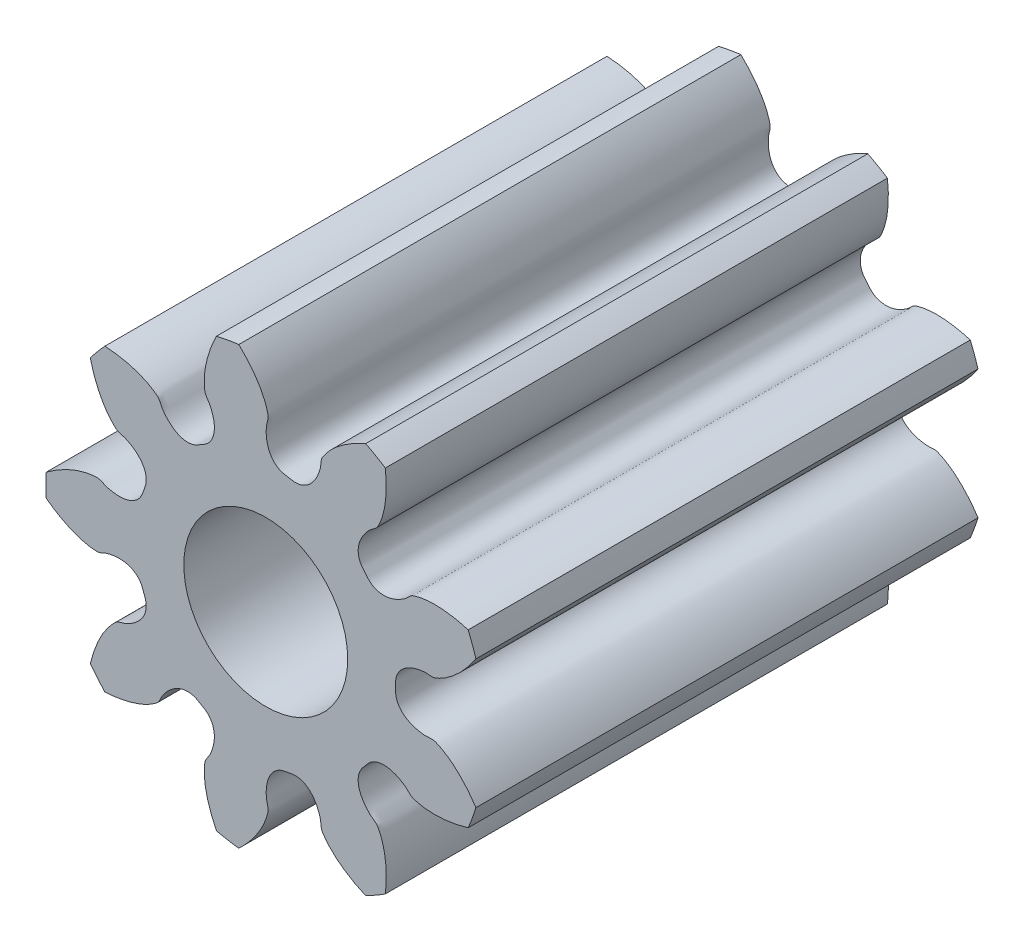
from build123d import *

# Parameters (mm, degrees)
SKETCHREVOLVESPURPINION_W       = 2.45
SKETCHREVOLVESPURPINION_H       = 1.072499984
TOOTHEXTRUDECUTSPURPINION_DEPTH = 9.525
PATTERNSPURPINION_COUNT         = 9
SKETCH5_R                       = 0.4
CUT_EXTRUDE2_DEPTH              = 10


with BuildPart() as part:
    # SketchRevolveSpurPinion → SpurPinion (revolve)
    with BuildSketch(Plane(origin=(0, 0, 0), x_dir=(0, 0, -1), z_dir=(1, 0, 0))):
        with Locations((0, 0.536249992)):
            Rectangle(SKETCHREVOLVESPURPINION_W, SKETCHREVOLVESPURPINION_H)
    revolve(axis=Axis((0, 0, 0), (0, 0, -1)))

    # SketchToothSpurPinion → ToothExtrudeCutSpurPinion (cut, symmetric)
    with BuildSketch(Plane.XY):
        with BuildLine():
            ThreePointArc((1.032247566, 0.325161484), (1.082249984, 0), (1.032247566, -0.325161484))
            add(Edge.make_bspline(
                [(1.032247566, -0.325161484), (1.022206938, -0.309187144), (1.006601454, -0.286440802), (0.984486531, -0.258339561), (0.968476019, -0.239682963), (0.952705439, -0.22281128), (0.937295714, -0.207668513), (0.922363363, -0.194191574), (0.908020112, -0.182310918), (0.894372588, -0.171949853), (0.881521811, -0.163028046), (0.869563428, -0.155451483), (0.858585637, -0.149146073), (0.848674484, -0.143953175), (0.83677536, -0.138531381), (0.814298743, -0.128203351), (0.789444146, -0.135002518), (0.768824799, -0.13282539), (0.760014632, -0.131822607), (0.751416093, -0.13046788), (0.74302129, -0.128839545), (0.734834489, -0.126916563), (0.726856642, -0.124702078), (0.719089636, -0.122190894), (0.711535476, -0.119377653), (0.704196911, -0.116254366), (0.697077831, -0.112810732), (0.690183915, -0.10903378), (0.683523437, -0.104907784), (0.67710831, -0.100414303), (0.670955362, -0.095532514), (0.665087833, -0.090239963), (0.659537015, -0.084513923), (0.654343858, -0.078333554), (0.649560276, -0.07168302), (0.64524947, -0.064555613), (0.641485571, -0.056958641), (0.638348521, -0.048918712), (0.635927125, -0.040485607), (0.634279456, -0.031736525), (0.633633562, -0.023840598), (0.633414226, -0.013245412), (0.63399976, 0), (0.633414226, 0.013245412), (0.633633562, 0.023840598), (0.634279456, 0.031736525), (0.635927125, 0.040485607), (0.638348521, 0.048918712), (0.641485571, 0.056958641), (0.64524947, 0.064555613), (0.649560276, 0.07168302), (0.654343858, 0.078333554), (0.659537015, 0.084513923), (0.665087833, 0.090239963), (0.670955362, 0.095532514), (0.67710831, 0.100414303), (0.683523437, 0.104907784), (0.690183915, 0.10903378), (0.697077831, 0.112810732), (0.704196911, 0.116254366), (0.711535476, 0.119377653), (0.719089636, 0.122190894), (0.726856642, 0.124702078), (0.734834489, 0.126916563), (0.74302129, 0.128839545), (0.751416093, 0.13046788), (0.760014632, 0.131822607), (0.768824799, 0.13282539), (0.789444146, 0.135002518), (0.814298743, 0.128203351), (0.83677536, 0.138531381), (0.848674484, 0.143953175), (0.858585637, 0.149146073), (0.869563428, 0.155451483), (0.881521811, 0.163028046), (0.894372588, 0.171949853), (0.908020112, 0.182310918), (0.922363363, 0.194191574), (0.937295714, 0.207668513), (0.952705439, 0.22281128), (0.968476019, 0.239682963), (0.984486531, 0.258339561), (1.006601454, 0.286440802), (1.022206938, 0.309187144), (1.032247566, 0.325161484)],
                knots=[0, 0, 0, 0, 0.050891122, 0.074327823, 0.096425284, 0.117183505, 0.136602487, 0.154682228, 0.171422729, 0.18682399, 0.200886011, 0.213608792, 0.224992334, 0.235036635, 0.243741696, 0.260392715, 0.300254045, 0.308375908, 0.31634364, 0.324164996, 0.33184861, 0.339404097, 0.346842168, 0.354174746, 0.361415081, 0.368577866, 0.375679329, 0.382737291, 0.389771166, 0.396801875, 0.403851609, 0.410943413, 0.41810051, 0.425345318, 0.432698114, 0.440175364, 0.447787819, 0.455538602, 0.463421637, 0.471420879, 0.479510758, 0.484758374, 0.5, 0.515241626, 0.520489242, 0.528579121, 0.536578363, 0.544461398, 0.552212181, 0.559824636, 0.567301886, 0.574654682, 0.58189949, 0.589056587, 0.596148391, 0.603198125, 0.610228834, 0.617262709, 0.624320671, 0.631422134, 0.638584919, 0.645825254, 0.653157832, 0.660595903, 0.66815139, 0.675835004, 0.68365636, 0.691624092, 0.699745955, 0.739607285, 0.756258304, 0.764963365, 0.775007666, 0.786391208, 0.799113989, 0.81317601, 0.828577271, 0.845317772, 0.863397513, 0.882816495, 0.903574716, 0.925672177, 0.949108878, 1, 1, 1, 1], degree=3))
        make_face()
    toothextrudecutspurpinion = extrude(amount=TOOTHEXTRUDECUTSPURPINION_DEPTH, both=True, mode=Mode.SUBTRACT)

    # PatternSpurPinion: ToothExtrudeCutSpurPinion ×9 about axis
    patternspurpinion_axis = Axis((0, 0, 55), (0, 0, -1))
    for i in range(1, PATTERNSPURPINION_COUNT):
        add(toothextrudecutspurpinion.rotate(patternspurpinion_axis, i * 360 / PATTERNSPURPINION_COUNT), mode=Mode.SUBTRACT)

    # Sketch5 → Cut-Extrude2 (cut)
    with BuildSketch(Plane.XY.offset(1.225)):
        Circle(SKETCH5_R)
    extrude(amount=-CUT_EXTRUDE2_DEPTH, mode=Mode.SUBTRACT)


solid = part.part
